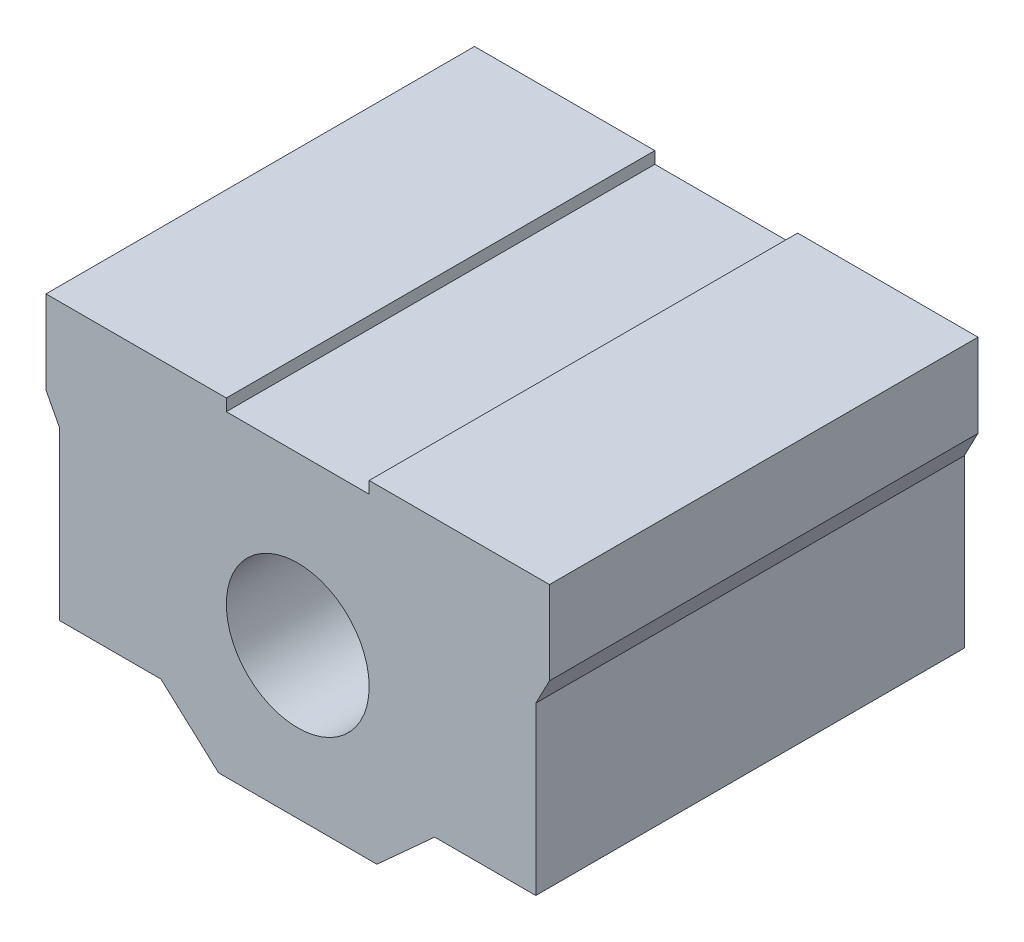
from build123d import *

# Parameters (mm, degrees)
SKETCH_1_R      = 6
EXTRUDE_1_DEPTH = 36


with BuildPart() as part:
    # 草图1 → 凸台-拉伸1 (new body)
    with BuildSketch(Plane.XY):
        Polygon((6.65, 0), (-6.65, 0), (-11.5, 4.4), (-20, 4.4), (-20, 18.4), (-21.15, 20.6), (-21.15, 27.6), (-6, 27.6), (-6, 26.6), (6, 26.6), (6, 27.6), (21.15, 27.6), (21.15, 20.6), (20, 18.4), (20, 4.4), (11.5, 4.4), align=None)
        with Locations((0, 12.6)):
            Circle(SKETCH_1_R, mode=Mode.SUBTRACT)
    extrude(amount=EXTRUDE_1_DEPTH)


solid = part.part
